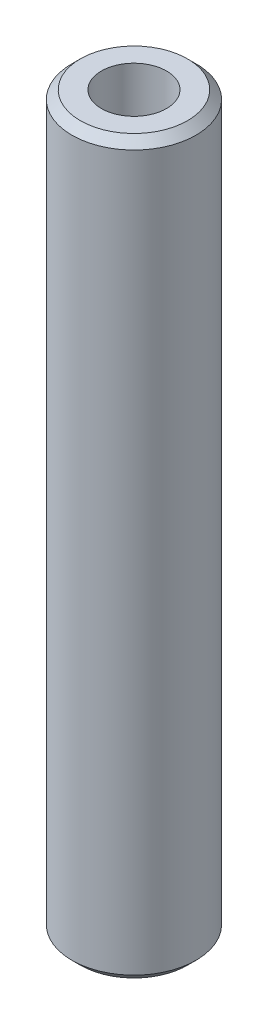
from build123d import *

# Parameters (mm, degrees)
SKETCH2_R           = 2.95
SKETCH2_R_2         = 1.55
BOSS_EXTRUDE1_DEPTH = 34.8
CHAMFER3_SIZE       = 0.4
CHAMFER4_SIZE       = 0.4


with BuildPart() as part:
    # Sketch2 → Boss-Extrude1 (new body)
    with BuildSketch(Plane(origin=(0, 0, 0), x_dir=(1, 0, 0), z_dir=(0, 1, 0))):
        with Locations(Location((0, 0, 0), (0, 0, 270))):
            Circle(SKETCH2_R)
        with Locations(Location((0, 0, 0), (0, 0, 270))):
            Circle(SKETCH2_R_2, mode=Mode.SUBTRACT)
    extrude(amount=BOSS_EXTRUDE1_DEPTH)

    # Chamfer3
    chamfer3_edges = [part.edges().sort_by_distance(p)[0] for p in [
        (0, 0, -2.95),
    ]]
    chamfer(chamfer3_edges, length=CHAMFER3_SIZE)

    # Chamfer4
    chamfer4_edges = [part.edges().sort_by_distance(p)[0] for p in [
        (0, 34.8, -2.95),
    ]]
    chamfer(chamfer4_edges, length=CHAMFER4_SIZE)


solid = part.part
